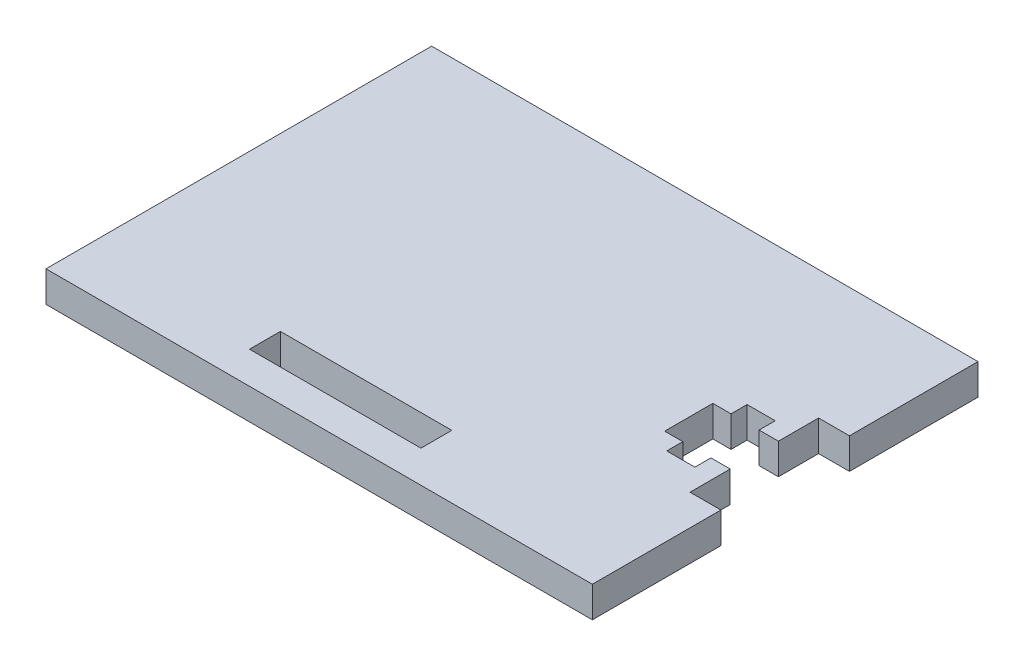
from build123d import *

# Parameters (mm, degrees)
SKETCH2_W           = 16.933333418
SKETCH2_H           = 3.048
BOSS_EXTRUDE1_DEPTH = 3.048


with BuildPart() as part:
    # Sketch2 → Boss-Extrude1 (new body)
    with BuildSketch(Plane(origin=(0, 0, 0), x_dir=(1, 0, 0), z_dir=(0, 1, 0))):
        Polygon((53.975, 25.4), (50.927, 25.4), (50.927, 21.43125), (49.022, 21.43125), (49.022, 23.01875), (46.243875, 23.01875), (46.243875, 21.43125), (44.45, 21.43125), (44.45, 16.66875), (46.243875, 16.66875), (46.243875, 15.08125), (49.022, 15.08125), (49.022, 16.66875), (50.927, 16.66875), (50.927, 12.7), (53.975, 12.7), (53.975, 0), (0, 0), (0, 38.1), (53.975, 38.1), align=None)
        with Locations((25.400000042, 4.699)):
            Rectangle(SKETCH2_W, SKETCH2_H, mode=Mode.SUBTRACT)
    extrude(amount=BOSS_EXTRUDE1_DEPTH)


solid = part.part
